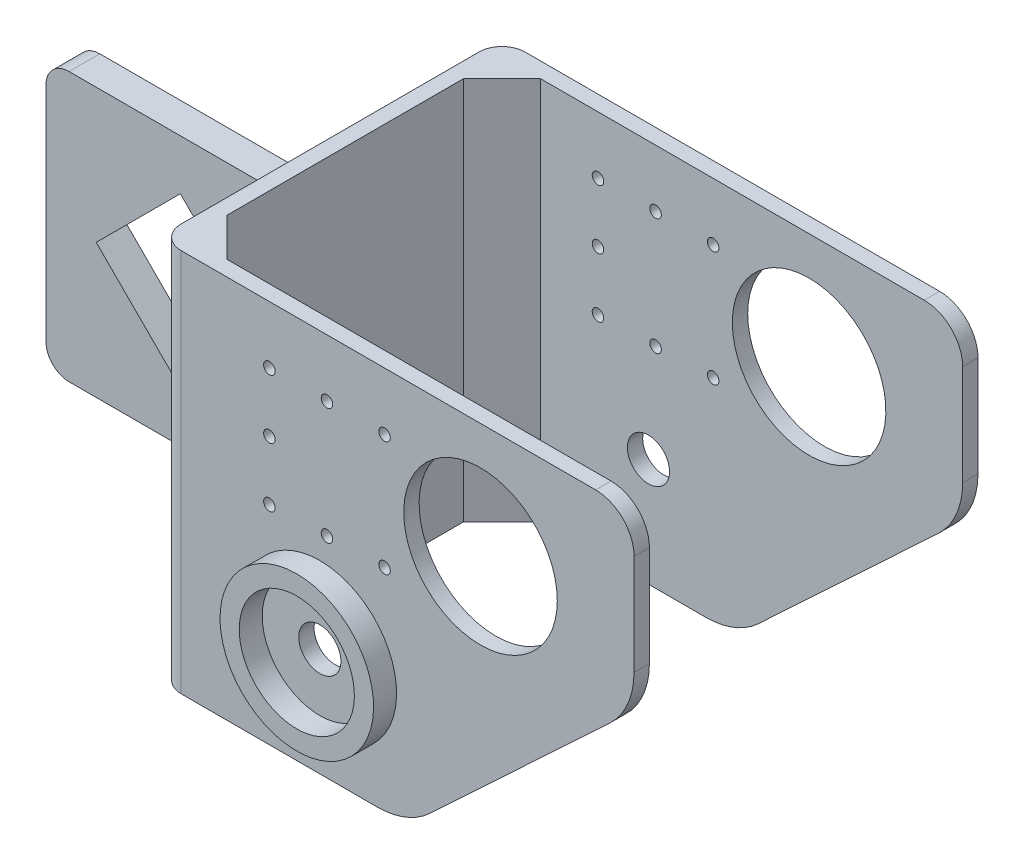
from build123d import *

# Parameters (mm, degrees)
SKETCH_3_R               = 3
EXTRUDE_6_DEPTH          = 0.001
EXTRUDE_6_2_DEPTH        = 0.001
EXTRUDE_6_3_DEPTH        = 0.001
EXTRUDE_6_4_DEPTH        = 0.001
CUT_EXTRUDE_2_DEPTH      = 67.213034483
CUT_EXTRUDE_2_DEPTH_BACK = 67.213034483
SKETCH_11_R              = 2.25
EXTRUDE_7_DEPTH          = 2
EXTRUDE_7_DEPTH_BACK     = 0.801922547
SKETCH_14_R              = 10
CUT_EXTRUDE_3_DEPTH      = 3
SKETCH_12_4_R            = 10
EXTRUDE_10_DEPTH         = 44
SKETCH_20_W              = 40.801922547
SKETCH_20_H              = 50
CUT_EXTRUDE_6_DEPTH      = 60
SKETCH_21_W              = 44.801922547
SKETCH_21_H              = 50
EXTRUDE_11_DEPTH         = 2
SKETCH_23_W              = 4
SKETCH_23_H              = 35
EXTRUDE_12_DEPTH         = 35
CUT_EXTRUDE_7_DEPTH      = 75.778269065
SKETCH_25_R              = 0.75
CUT_EXTRUDE_8_DEPTH      = 84.687483396
FILLET_2_R               = 5
FILLET_3_R               = 5
FILLET_5_R               = 3
FILLET_6_R               = 3
FILLET_7_R               = 3
FILLET_8_R               = 3
SKETCH_26_R              = 2.75
CUT_EXTRUDE_9_DEPTH      = 100
SKETCH_27_R              = 10
SKETCH_27_R_2            = 7.5
EXTRUDE_13_DEPTH         = 5
SKETCH_28_R              = 10
SKETCH_28_R_2            = 7.5
EXTRUDE_14_DEPTH         = 5
CUT_EXTRUDE_10_DEPTH     = 86.331157337
CUT_EXTRUDE_11_DEPTH     = 86.331157337
CUT_EXTRUDE_12_DEPTH     = 86.331157337
EXTRUDE_15_DEPTH         = 50


with BuildPart() as part:
    # 草图3 → 凸台-拉伸6 (new body)
    with BuildSketch(Plane.XY):
        with Locations((60.266478541, 16.532501821)):
            Circle(SKETCH_3_R)
    extrude(amount=EXTRUDE_6_DEPTH)


with BuildPart() as body_2:
    # 草图3 → Extrude 6 2 (new body)
    with BuildSketch(Plane.XY):
        with Locations((60.266478541, 6.532501821)):
            Circle(SKETCH_3_R)
    extrude(amount=EXTRUDE_6_2_DEPTH)


with BuildPart() as body_3:
    # 草图3 → Extrude 6 3 (new body)
    with BuildSketch(Plane.XY):
        with Locations((10.766478541, 6.532501821)):
            Circle(SKETCH_3_R)
    extrude(amount=EXTRUDE_6_3_DEPTH)


with BuildPart() as body_4:
    # 草图3 → Extrude 6 4 (new body)
    with BuildSketch(Plane.XY):
        with Locations((10.766478541, 16.532501821)):
            Circle(SKETCH_3_R)
    extrude(amount=EXTRUDE_6_4_DEPTH)


with BuildPart() as cut_extrude_2_tool:
    # 草图11 → 切除-拉伸2 (new, two sides: drawn at the far end of the back side and taken through both)
    with BuildSketch(Plane.XY.offset(0.001).offset(-CUT_EXTRUDE_2_DEPTH_BACK)):
        with Locations((10.766478541, 16.532501821)):
            Circle(SKETCH_11_R)
        with Locations((10.766478541, 6.532501821)):
            Circle(SKETCH_11_R)
        with Locations((60.266478541, 16.532501821)):
            Circle(SKETCH_11_R)
        with Locations((60.266478541, 6.532501821)):
            Circle(SKETCH_11_R)
    extrude(amount=CUT_EXTRUDE_2_DEPTH + CUT_EXTRUDE_2_DEPTH_BACK)


with BuildPart() as part_1:
    add(part.part)

    # 切除-拉伸2: cut by cut_extrude_2_tool
    add(cut_extrude_2_tool.part, mode=Mode.SUBTRACT)



with BuildPart() as body_2_1:
    add(body_2.part)

    # 切除-拉伸2: cut by cut_extrude_2_tool
    add(cut_extrude_2_tool.part, mode=Mode.SUBTRACT)


with BuildPart() as body_3_1:
    add(body_3.part)

    # 切除-拉伸2: cut by cut_extrude_2_tool
    add(cut_extrude_2_tool.part, mode=Mode.SUBTRACT)


with BuildPart() as body_4_1:
    add(body_4.part)

    # 切除-拉伸2: cut by cut_extrude_2_tool
    add(cut_extrude_2_tool.part, mode=Mode.SUBTRACT)


with BuildPart() as body_5:
    # 草图12 → 凸台-拉伸7 (new, two sides: drawn at the far end of the back side and taken through both)
    with BuildSketch(Plane.XY.offset(0.001).offset(-EXTRUDE_7_DEPTH_BACK)):
        Polygon((5.516478541, 26.532501821), (65.516478541, 26.532501821), (65.516478541, -23.467498179), (5.516478541, -23.467498179), (5.516478541, 1.532501821), align=None)
    extrude(amount=EXTRUDE_7_DEPTH + EXTRUDE_7_DEPTH_BACK)

    # 草图14 → 切除-拉伸3 (cut)
    with BuildSketch(Plane(origin=(0, 0, -0.800922547), x_dir=(-1, 0, 0), z_dir=(0, 0, -1))):
        with Locations((-45.516478541, 11.532501821)):
            Circle(SKETCH_14_R)
    extrude(amount=-CUT_EXTRUDE_3_DEPTH, mode=Mode.SUBTRACT)


with BuildPart() as part_2:
    add(part_1.part)

    add(body_2_1.part)  # 凸台-拉伸10 merges body 2

    add(body_3_1.part)  # 凸台-拉伸10 merges body 3

    add(body_4_1.part)  # 凸台-拉伸10 merges body 4

    add(body_5.part)  # 凸台-拉伸10 merges body 5
    # 草图12<4> → 凸台-拉伸10 (add)
    with BuildSketch(Plane.XY.offset(0.001)):
        Polygon((5.516478541, 26.532501821), (65.516478541, 26.532501821), (65.516478541, -23.467498179), (5.516478541, -23.467498179), (5.516478541, 1.532501821), align=None)
        with Locations((45.516478541, 11.532501821)):
            Circle(SKETCH_12_4_R, mode=Mode.SUBTRACT)
    extrude(amount=EXTRUDE_10_DEPTH)

    # 草图20 → 切除-拉伸6 (cut)
    with BuildSketch(Plane(origin=(65.516478541, 0, 0), x_dir=(0, 0, -1), z_dir=(1, 0, 0))):
        with Locations((-21.600038727, 1.532501821)):
            Rectangle(SKETCH_20_W, SKETCH_20_H)
    extrude(amount=-CUT_EXTRUDE_6_DEPTH, mode=Mode.SUBTRACT)


with BuildPart() as cut_extrude_6_piece_1:
    # of the separate pieces the step leaves, piece 1, a body of its own (cut_extrude_6_pieces)
    add(part_2.part.solids().sort_by_distance((5.516478541, 26.532501821, 42.001))[0])



with BuildPart() as cut_extrude_6_piece_2:
    # of the separate pieces the step leaves, piece 2, a body of its own (cut_extrude_6_pieces)
    add(part_2.part.solids().sort_by_distance((5.516478541, 26.532501821, -0.800922547))[0])


with BuildPart() as cut_extrude_6_piece_1_1:
    add(cut_extrude_6_piece_1.part)

    add(cut_extrude_6_piece_2.part)  # 凸台-拉伸11 merges 切除-拉伸6 piece 2
    # 草图21 → 凸台-拉伸11 (add)
    with BuildSketch(Plane.ZY.offset(-5.516478541)):
        with Locations((21.600038727, 1.532501821)):
            Rectangle(SKETCH_21_W, SKETCH_21_H)
    extrude(amount=EXTRUDE_11_DEPTH)

    # 草图23 → 凸台-拉伸12 (add)
    with BuildSketch(Plane.ZY.offset(-3.516478541)):
        with Locations((21.600038726, 1.532501821)):
            Rectangle(SKETCH_23_W, SKETCH_23_H)
    extrude(amount=EXTRUDE_12_DEPTH)

    # 草图24 → 切除-拉伸7 (cut, through all)
    with BuildSketch(Plane.XY.offset(23.600038726)):
        Polygon((-13.983521459, 12.492501821), (-24.943676567, 1.532346713), (-13.983521459, -9.427808395), (-3.023366351, 1.532346713), align=None)
    extrude(amount=-CUT_EXTRUDE_7_DEPTH, mode=Mode.SUBTRACT)

    # 草图25 → 切除-拉伸8 (cut, through all)
    with BuildSketch(Plane(origin=(0, 0, -0.800922547), x_dir=(-1, 0, 0), z_dir=(0, 0, -1))):
        with Locations((-33.016478541, 19.032501821)):
            Circle(SKETCH_25_R)
        with Locations((-33.016478541, 4.032501821)):
            Circle(SKETCH_25_R)
        with Locations((-18.016478541, 19.032501821)):
            Circle(SKETCH_25_R)
        with Locations((-18.016478541, 3.622989742)):
            Circle(SKETCH_25_R)
        with Locations((-25.516478541, 19.032501821)):
            Circle(SKETCH_25_R)
        with Locations((-25.516478541, 3.827745781)):
            Circle(SKETCH_25_R)
        with Locations((-18.016478541, 11.327745781)):
            Circle(SKETCH_25_R)
    extrude(amount=-CUT_EXTRUDE_8_DEPTH, mode=Mode.SUBTRACT)

    # 圆角2
    fillet_2_edges = [cut_extrude_6_piece_1_1.edges().sort_by_distance(p)[0] for p in [
        (65.516478541, 26.532501821, 0.199077453),
    ]]
    fillet(fillet_2_edges, radius=FILLET_2_R)

    # 圆角3
    fillet_3_edges = [cut_extrude_6_piece_1_1.edges().sort_by_distance(p)[0] for p in [
        (65.516478541, 26.532501821, 43.001),
    ]]
    fillet(fillet_3_edges, radius=FILLET_3_R)

    # 圆角5
    fillet_5_edges = [cut_extrude_6_piece_1_1.edges().sort_by_distance(p)[0] for p in [
        (3.516478541, 1.532501821, 44.001),
    ]]
    fillet(fillet_5_edges, radius=FILLET_5_R)

    # 圆角6
    fillet_6_edges = [cut_extrude_6_piece_1_1.edges().sort_by_distance(p)[0] for p in [
        (3.516478541, 1.532501821, -0.800922547),
    ]]
    fillet(fillet_6_edges, radius=FILLET_6_R)

    # 圆角7
    fillet_7_edges = [cut_extrude_6_piece_1_1.edges().sort_by_distance(p)[0] for p in [
        (-31.483521459, -15.967498179, 21.600038726),
    ]]
    fillet(fillet_7_edges, radius=FILLET_7_R)

    # 圆角8
    fillet_8_edges = [cut_extrude_6_piece_1_1.edges().sort_by_distance(p)[0] for p in [
        (-31.483521459, 19.032501821, 21.600038726),
    ]]
    fillet(fillet_8_edges, radius=FILLET_8_R)

    # 草图26 → 切除-拉伸9 (cut)
    with BuildSketch(Plane(origin=(0, 0, -0.800922547), x_dir=(-1, 0, 0), z_dir=(0, 0, -1))):
        with Locations((-24.586117818, -9.397858902)):
            Circle(SKETCH_26_R)
    extrude(amount=-CUT_EXTRUDE_9_DEPTH, mode=Mode.SUBTRACT)

    # 草图27 → 凸台-拉伸13 (add)
    with BuildSketch(Plane.XY.offset(1.199077453)):
        with Locations((24.586117818, -9.397858902)):
            Circle(SKETCH_27_R)
        with Locations((24.586117818, -9.397858902)):
            Circle(SKETCH_27_R_2, mode=Mode.SUBTRACT)
    extrude(amount=-EXTRUDE_13_DEPTH)

    # 草图28 → 凸台-拉伸14 (add)
    with BuildSketch(Plane(origin=(0, 0, 42.001), x_dir=(-1, 0, 0), z_dir=(0, 0, -1))):
        with Locations((-24.586117818, -9.397858902)):
            Circle(SKETCH_28_R)
        with Locations((-24.586117818, -9.397858902)):
            Circle(SKETCH_28_R_2, mode=Mode.SUBTRACT)
    extrude(amount=-EXTRUDE_14_DEPTH)

    # 草图29 → 切除-拉伸10 (cut, through all)
    with BuildSketch(Plane(origin=(0, 0, -0.800922547), x_dir=(-1, 0, 0), z_dir=(0, 0, -1))):
        Polygon((-65.516478541, 4.105503733), (-36.016478541, -23.467498179), (-65.516478541, -23.467498179), align=None)
    extrude(amount=-CUT_EXTRUDE_10_DEPTH, mode=Mode.SUBTRACT)

    # 草图31 → 切除-拉伸11 (cut, through all)
    with BuildSketch(Plane(origin=(0, 0, -0.800922547), x_dir=(-1, 0, 0), z_dir=(0, 0, -1))):
        with BuildLine():
            Line((-36.016478541, -23.467498179), (-38.899128386, -20.773148698))
            ThreePointArc((-38.899128386, -20.773148698), (-35.741085253, -22.769554543), (-32.070697344, -23.467498179))
            Line((-32.070697344, -23.467498179), (-36.016478541, -23.467498179))
        make_face()
    extrude(amount=-CUT_EXTRUDE_11_DEPTH, mode=Mode.SUBTRACT)

    # 草图32 → 切除-拉伸12 (cut, through all)
    with BuildSketch(Plane(origin=(0, 0, -0.800922547), x_dir=(-1, 0, 0), z_dir=(0, 0, -1))):
        with BuildLine():
            Line((-65.516478541, 8.446758423), (-65.516478541, 4.105503733))
            Line((-65.516478541, 4.105503733), (-62.344909583, 1.141107904))
            ThreePointArc((-62.344909583, 1.141107904), (-64.689381855, 4.46456747), (-65.516478541, 8.446758423))
        make_face()
    extrude(amount=-CUT_EXTRUDE_12_DEPTH, mode=Mode.SUBTRACT)

    # 草图35 → 凸台-拉伸15 (add)
    with BuildSketch(Plane.XZ.offset(23.467498179)):
        Polygon((5.516478541, 42.001), (10.516478541, 42.001), (5.516478541, 37.001), align=None)
        Polygon((5.516478541, 1.199077453), (5.516478541, 6.199077453), (10.516478541, 1.199077453), align=None)
    extrude(amount=-EXTRUDE_15_DEPTH)


solid = cut_extrude_6_piece_1_1.part
